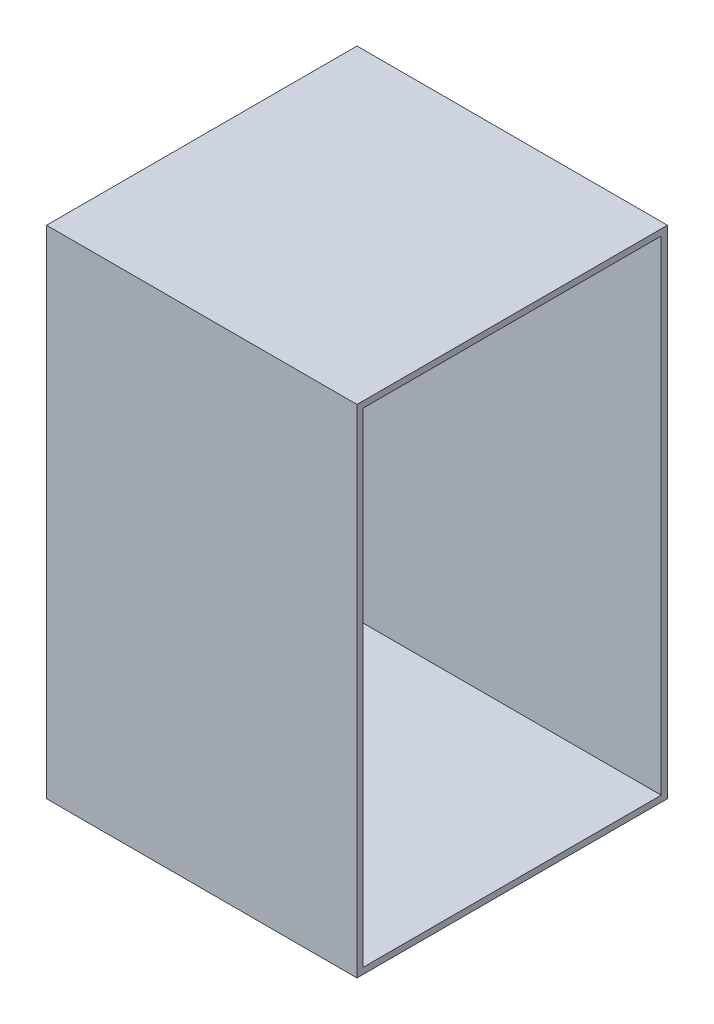
from build123d import *

# Parameters (mm, degrees)
SKETCH_1_W          = 500
SKETCH_1_H          = 500
EXTRUDE_1_DEPTH     = 400
SKETCH_2_W          = 480
SKETCH_2_H          = 780
CUT_EXTRUDE_1_DEPTH = 490


with BuildPart() as part:
    # 草图1 → 凸台-拉伸1 (new, symmetric)
    with BuildSketch(Plane(origin=(0, 0, 0), x_dir=(1, 0, 0), z_dir=(0, 1, 0))):
        Rectangle(SKETCH_1_W, SKETCH_1_H)
    extrude(amount=EXTRUDE_1_DEPTH, both=True)

    # 草图2 → 切除-拉伸1 (cut)
    with BuildSketch(Plane(origin=(250, 0, 0), x_dir=(0, 0, -1), z_dir=(1, 0, 0))):
        Rectangle(SKETCH_2_W, SKETCH_2_H)
    extrude(amount=-CUT_EXTRUDE_1_DEPTH, mode=Mode.SUBTRACT)


solid = part.part
